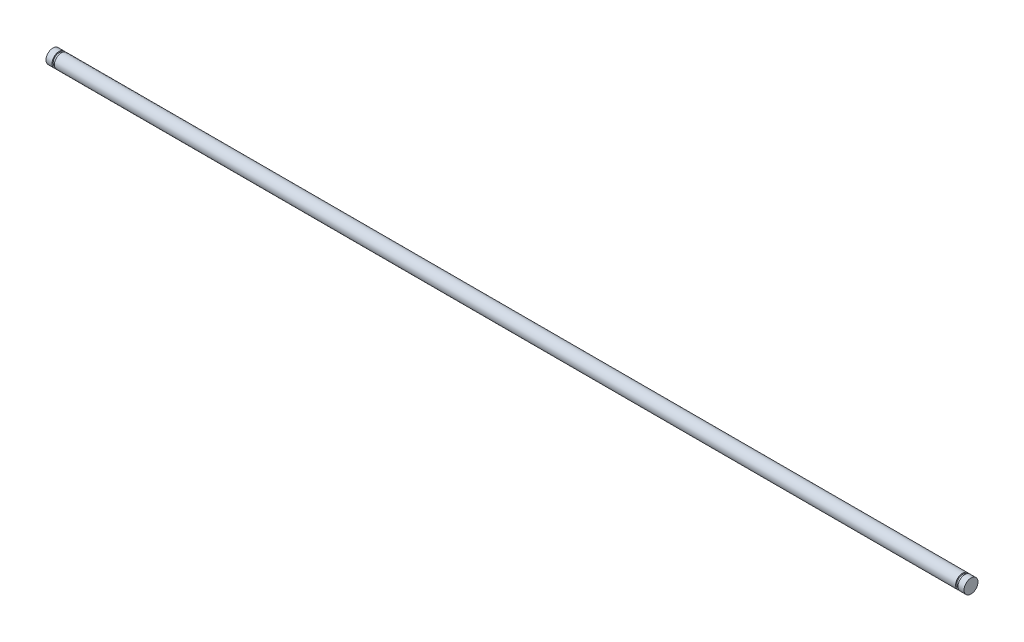
from build123d import *

# Parameters (mm, degrees)
SKETCH1_R           = 1.5
BOSS_EXTRUDE1_DEPTH = 197
SKETCH2_W           = 0.5
SKETCH2_H           = 0.25


with BuildPart() as part:
    # Sketch1 → Boss-Extrude1 (new body)
    with BuildSketch(Plane(origin=(0, 0, 0), x_dir=(0, 0, -1), z_dir=(1, 0, 0))):
        Circle(SKETCH1_R)
    extrude(amount=BOSS_EXTRUDE1_DEPTH)

    # Sketch2 → Cut-Revolve1 (revolve, cut)
    with BuildSketch(Plane.XY, mode=Mode.PRIVATE) as cut_revolve1_sk:
        with Locations((1.55, 1.375)):
            Rectangle(SKETCH2_W, SKETCH2_H)
    cut_revolve1 = revolve(cut_revolve1_sk.sketch.rotate(Axis((197, 0, 0), (-1, 0, 0)), 90), axis=Axis((197, 0, 0), (-1, 0, 0)), mode=Mode.SUBTRACT)

    # Mirror1: Cut-Revolve1 across plane
    add(cut_revolve1.mirror(Plane.ZY.offset(-98.5)), mode=Mode.SUBTRACT)


solid = part.part
